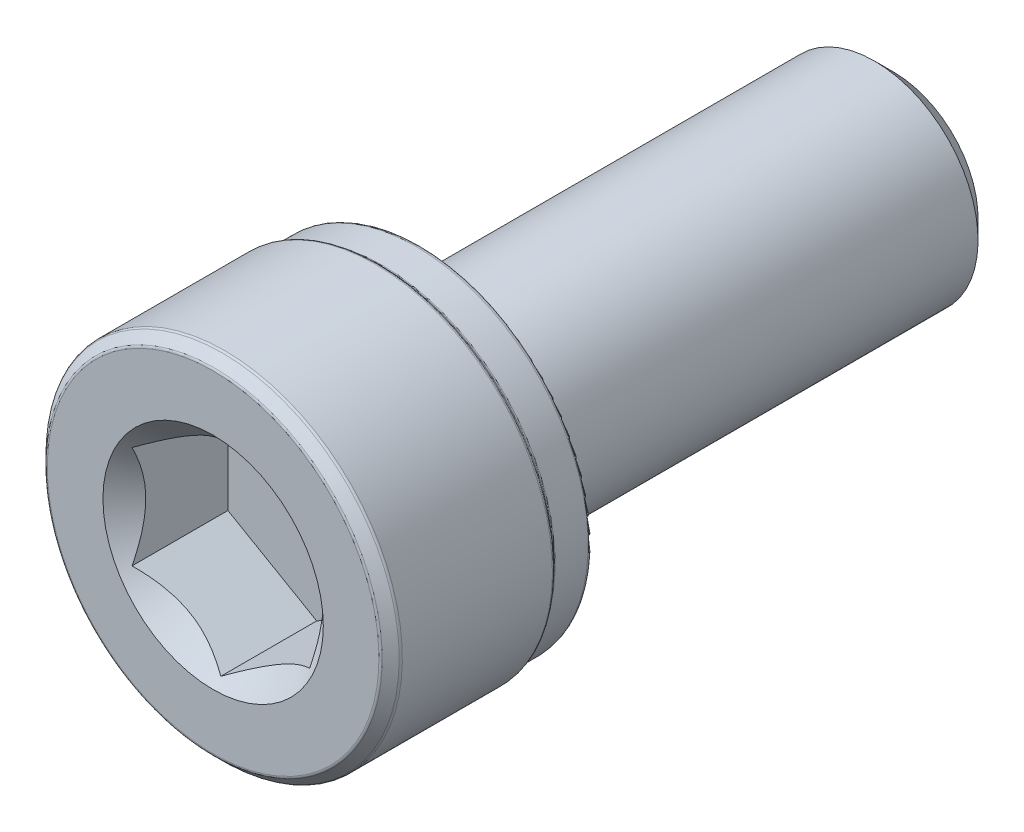
from build123d import *

# Parameters (mm, degrees)
CUT_EXTRUDE1_START = -3.5
CUT_EXTRUDE1_DEPTH = 3.5
SKETCH4_R          = 3.723909236
CUT_EXTRUDE2_DEPTH = 3.5
CUT_EXTRUDE2_DRAFT = -45


with BuildPart() as part:
    # Sketch2 → Revolve1 (revolve)
    with BuildSketch(Plane(origin=(0, 0, 0), x_dir=(0, 0, -1), z_dir=(1, 0, 0))):
        with BuildLine():
            Line((-11.5, 0), (-11.5, 5.604695392))
            ThreePointArc((-11.5, 5.604695392), (-11.491674324, 5.646551392), (-11.467964804, 5.682035196))
            Line((-11.467964804, 5.682035196), (-11.182035196, 5.967964804))
            ThreePointArc((-11.182035196, 5.967964804), (-11.146551392, 5.991674324), (-11.104695392, 6))
            Line((-11.104695392, 6), (-6.032804608, 6))
            ThreePointArc((-6.032804608, 6), (-5.990948608, 5.991674324), (-5.955464804, 5.967964804))
            Line((-5.955464804, 5.967964804), (-5.844535196, 5.857035196))
            ThreePointArc((-5.844535196, 5.857035196), (-5.809051392, 5.833325676), (-5.767195392, 5.825))
            Line((-5.767195392, 5.825), (-4.65, 5.825))
            ThreePointArc((-4.65, 5.825), (-4.543933983, 5.781066017), (-4.5, 5.675))
            Line((-4.5, 5.675), (-4.5, 3.85))
            ThreePointArc((-4.5, 3.85), (-4.397487373, 3.602512627), (-4.15, 3.5))
            Line((-4.15, 3.5), (10.850480947, 3.5))
            Line((10.850480947, 3.5), (11.5, 2.850480947))
            Line((11.5, 2.850480947), (11.5, 0))
            Line((11.5, 0), (-11.5, 0))
        make_face()
    revolve(axis=Axis((0, 0, -11.5), (0, 0, 1)))

    # Sketch3 → Cut-Extrude1 (cut)
    with BuildSketch(Plane.XY.offset(11.5).offset(CUT_EXTRUDE1_START)):
        Polygon((3, -1.732050808), (3, 1.732050808), (0, 3.464101615), (-3, 1.732050808), (-3, -1.732050808), (0, -3.464101615), align=None)
    extrude(amount=CUT_EXTRUDE1_DEPTH, mode=Mode.SUBTRACT)


with BuildPart() as cut_extrude2_tool:
    # Sketch4 → Cut-Extrude2 (with draft: the straight prism first)
    with BuildSketch(Plane.XY.offset(11.5)):
        Circle(SKETCH4_R)
    extrude(amount=-CUT_EXTRUDE2_DEPTH)
    # Cut-Extrude2: the draft: its side faces are tilted about the plane it starts from
    cut_extrude2_sides = [cut_extrude2_tool.faces().sort_by_distance(p)[0] for p in [
        (-3.723909236, 0, 9.75),
    ]]
    draft(cut_extrude2_sides, Plane.XY.offset(11.5), CUT_EXTRUDE2_DRAFT)


with BuildPart() as part_1:
    add(part.part)

    # Cut-Extrude2: cut by cut_extrude2_tool
    add(cut_extrude2_tool.part, mode=Mode.SUBTRACT)


solid = part_1.part
